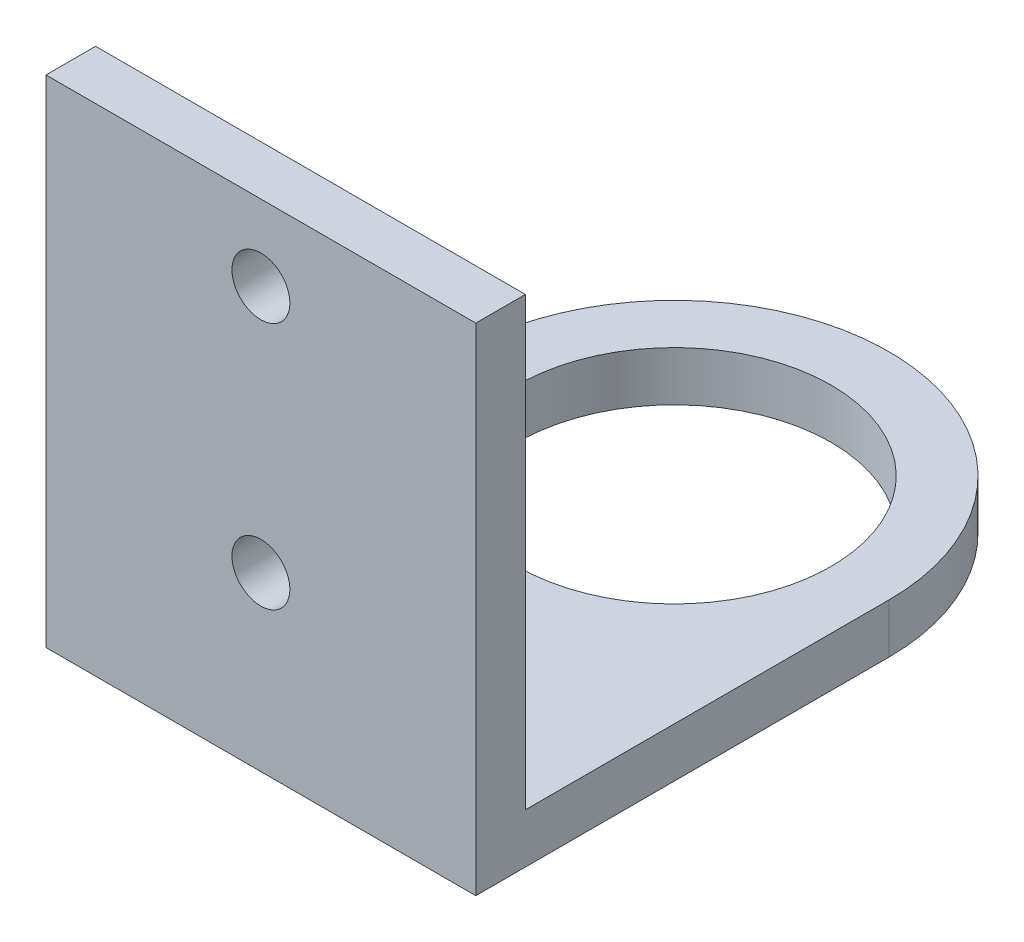
from build123d import *

# Parameters (mm, degrees)
SKETCH_1_R          = 13
SKETCH_1_R_2        = 9.5
EXTRUDE_1_DEPTH     = 3
SKETCH_2_W          = 26
SKETCH_2_H          = 30
EXTRUDE_2_DEPTH     = 3
SKETCH_3_R          = 1.75
CUT_EXTRUDE_1_DEPTH = 3


with BuildPart() as part:
    # 草图1 → 凸台-拉伸1 (new body)
    # profile 1 of 2: a face of its own
    with BuildSketch(Plane(origin=(0, 0, 0), x_dir=(1, 0, 0), z_dir=(0, 1, 0))):
        Circle(SKETCH_1_R)
        with Locations(Location((0, 0, 0), (0, 0, 270))):
            Circle(SKETCH_1_R_2, mode=Mode.SUBTRACT)
    # profile 2 of 2: a face of its own
    with BuildSketch(Plane(origin=(0, 0, 0), x_dir=(1, 0, 0), z_dir=(0, 1, 0))):
        with BuildLine():
            ThreePointArc((13, 0), (0, -13), (-13, 0))
            Line((-13, 0), (-13, -25))
            Line((-13, -25), (13, -25))
            Line((13, -25), (13, 0))
        make_face()
    extrude(amount=EXTRUDE_1_DEPTH)

    # 草图2 → 凸台-拉伸2 (add)
    with BuildSketch(Plane.XY.offset(25)):
        with Locations((0, 15)):
            Rectangle(SKETCH_2_W, SKETCH_2_H)
    extrude(amount=-EXTRUDE_2_DEPTH)

    # 草图3 → 切除-拉伸1 (cut)
    with BuildSketch(Plane(origin=(0, 0, 22), x_dir=(-1, 0, 0), z_dir=(0, 0, -1))):
        with Locations((0, 10.422083653)):
            Circle(SKETCH_3_R)
        with Locations((0, 25.422083653)):
            Circle(SKETCH_3_R)
    extrude(amount=-CUT_EXTRUDE_1_DEPTH, mode=Mode.SUBTRACT)


solid = part.part
